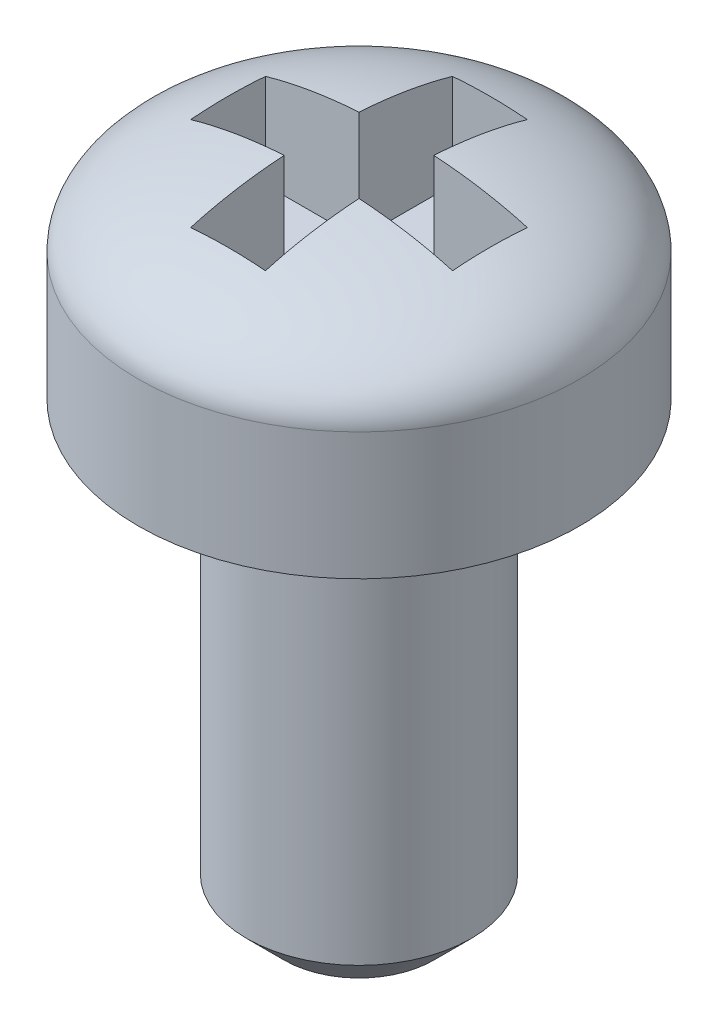
from build123d import *

# Parameters (mm, degrees)
CUT_EXTRUDE1_DEPTH = 1.5


with BuildPart() as part:
    # Sketch1 → Revolve1 (revolve)
    with BuildSketch(Plane.XY, mode=Mode.PRIVATE) as revolve1_sk:
        with BuildLine():
            Line((-1.5, -2.85), (-1.5, -8.35))
            Line((-1.5, -8.35), (-1, -8.85))
            Line((-1, -8.85), (0, -8.85))
            Line((0, -8.85), (0, 0))
            add(Edge.make_bspline(
                [(0, 0), (-2.95, 0), (-2.95, -1.15)],
                knots=[4.71238898, 4.71238898, 4.71238898, 6.283185307, 6.283185307, 6.283185307], degree=2, weights=[1, 0.707106781, 1]))
            Line((-2.95, -1.15), (-2.95, -2.85))
            Line((-2.95, -2.85), (-1.5, -2.85))
        make_face()
    revolve(revolve1_sk.sketch.rotate(Axis((0, 0, 0), (0, -1, 0)), 270), axis=Axis((0, 0, 0), (0, -1, 0)))

    # Sketch2 → Cut-Extrude1 (cut)
    with BuildSketch(Plane(origin=(0, 0, 0), x_dir=(1, 0, 0), z_dir=(0, 1, 0))):
        Polygon((-1.75, 0.5), (-0.5, 0.5), (-0.5, 1.75), (0.5, 1.75), (0.5, 0.5), (1.75, 0.5), (1.75, -0.5), (0.5, -0.5), (0.5, -1.75), (-0.5, -1.75), (-0.5, -0.5), (-1.75, -0.5), align=None)
    extrude(amount=-CUT_EXTRUDE1_DEPTH, mode=Mode.SUBTRACT)


solid = part.part
